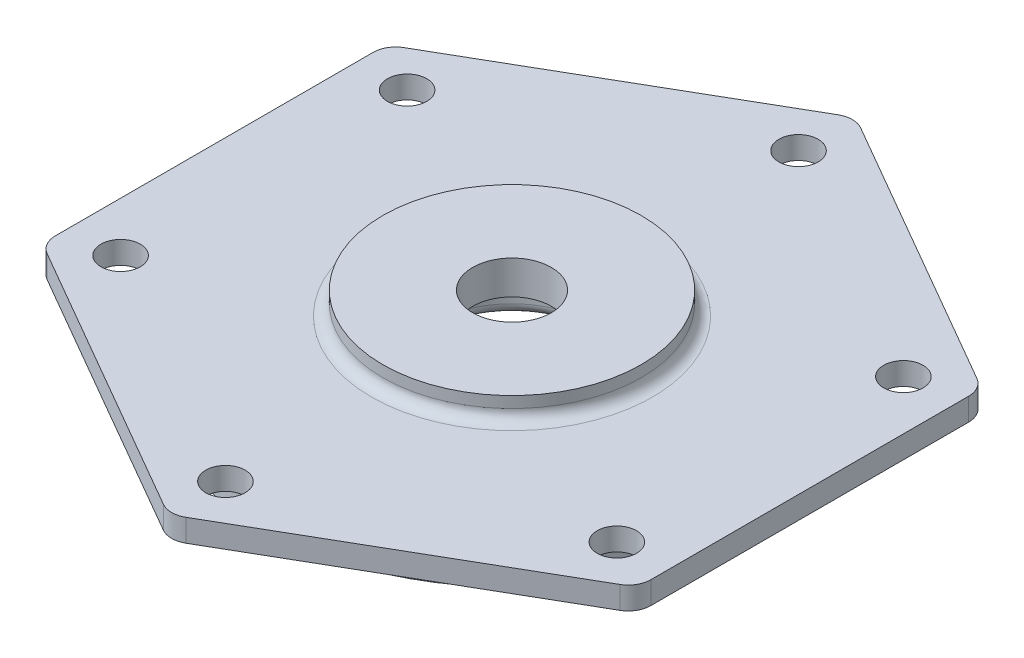
from build123d import *

# Parameters (mm, degrees)
BOSS_EXTRUDE1_DEPTH = 4
SKETCH2_R           = 23
BOSS_EXTRUDE2_DEPTH = 4
SKETCH3_R           = 45
BOSS_EXTRUDE3_DEPTH = 6
SKETCH4_R           = 40
SKETCH4_R_2         = 19
CUT_EXTRUDE1_DEPTH  = 6
SKETCH5_R           = 14
CUT_EXTRUDE2_DEPTH  = 8
SKETCH6_R           = 7
CUT_EXTRUDE3_DEPTH  = 81.888663881
FILLET1_R           = 2
SKETCH7_R           = 3.5
CUT_EXTRUDE4_DEPTH  = 82.110886719


with BuildPart() as part:
    # Sketch1 → Boss-Extrude1 (new body)
    with BuildSketch(Plane(origin=(0, 0, 0), x_dir=(1, 0, 0), z_dir=(0, 1, 0))):
        with BuildLine():
            Line((-51, -31.754264805), (-2, -60.044427996))
            ThreePointArc((-2, -60.044427996), (0, -60.580326381), (2, -60.044427996))
            Line((2, -60.044427996), (51, -31.754264805))
            ThreePointArc((51, -31.754264805), (52.464101615, -30.29016319), (53, -28.29016319))
            Line((53, -28.29016319), (53, 28.29016319))
            ThreePointArc((53, 28.29016319), (52.464101615, 30.29016319), (51, 31.754264805))
            Line((51, 31.754264805), (2, 60.044427996))
            ThreePointArc((2, 60.044427996), (0, 60.580326381), (-2, 60.044427996))
            Line((-2, 60.044427996), (-51, 31.754264805))
            ThreePointArc((-51, 31.754264805), (-52.464101615, 30.29016319), (-53, 28.29016319))
            Line((-53, 28.29016319), (-53, -28.29016319))
            ThreePointArc((-53, -28.29016319), (-52.464101615, -30.29016319), (-51, -31.754264805))
        make_face()
    extrude(amount=BOSS_EXTRUDE1_DEPTH)

    # Sketch2 → Boss-Extrude2 (add)
    with BuildSketch(Plane(origin=(0, 4, 0), x_dir=(1, 0, 0), z_dir=(0, 1, 0))):
        with Locations(Location((0, 0, 0), (0, 0, 270))):
            Circle(SKETCH2_R)
    extrude(amount=BOSS_EXTRUDE2_DEPTH)

    # Sketch3 → Boss-Extrude3 (add)
    with BuildSketch(Plane.XZ):
        with Locations(Location((0, 0, 0), (0, 0, 270))):
            Circle(SKETCH3_R)
    extrude(amount=BOSS_EXTRUDE3_DEPTH)

    # Sketch4 → Cut-Extrude1 (cut)
    with BuildSketch(Plane.XZ.offset(6)):
        with Locations(Location((0, 0, 0), (0, 0, 270))):
            Circle(SKETCH4_R)
        with Locations(Location((0, 0, 0), (0, 0, 270))):
            Circle(SKETCH4_R_2, mode=Mode.SUBTRACT)
    extrude(amount=-CUT_EXTRUDE1_DEPTH, mode=Mode.SUBTRACT)

    # Sketch5 → Cut-Extrude2 (cut)
    with BuildSketch(Plane.XZ.offset(6)):
        with Locations(Location((0, 0, 0), (0, 0, 270))):
            Circle(SKETCH5_R)
    extrude(amount=-CUT_EXTRUDE2_DEPTH, mode=Mode.SUBTRACT)

    # Sketch6 → Cut-Extrude3 (cut, through all)
    with BuildSketch(Plane.XZ.offset(-2)):
        with Locations(Location((0, 0, 0), (0, 0, 270))):
            Circle(SKETCH6_R)
    extrude(amount=-CUT_EXTRUDE3_DEPTH, mode=Mode.SUBTRACT)

    # Fillet1
    fillet1_edges = [part.edges().sort_by_distance(p)[0] for p in [
        (0, 4, -23),
        (0, -6, 40),
        (0, -6, 14),
    ]]
    fillet(fillet1_edges, radius=FILLET1_R)

    # Sketch7 → Cut-Extrude4 (cut, through all)
    with BuildSketch(Plane(origin=(0, 4, 0), x_dir=(1, 0, 0), z_dir=(0, 1, 0))):
        with Locations(Location((0, 51, 0), (0, 0, 270))):
            Circle(SKETCH7_R)
        with Locations(Location((44.167295593, 25.5, 0), (0, 0, 270))):
            Circle(SKETCH7_R)
        with Locations(Location((44.167295593, -25.5, 0), (0, 0, 270))):
            Circle(SKETCH7_R)
        with Locations(Location((0, -51, 0), (0, 0, 270))):
            Circle(SKETCH7_R)
        with Locations(Location((-44.167295593, -25.5, 0), (0, 0, 270))):
            Circle(SKETCH7_R)
        with Locations(Location((-44.167295593, 25.5, 0), (0, 0, 270))):
            Circle(SKETCH7_R)
    extrude(amount=-CUT_EXTRUDE4_DEPTH, mode=Mode.SUBTRACT)


solid = part.part
